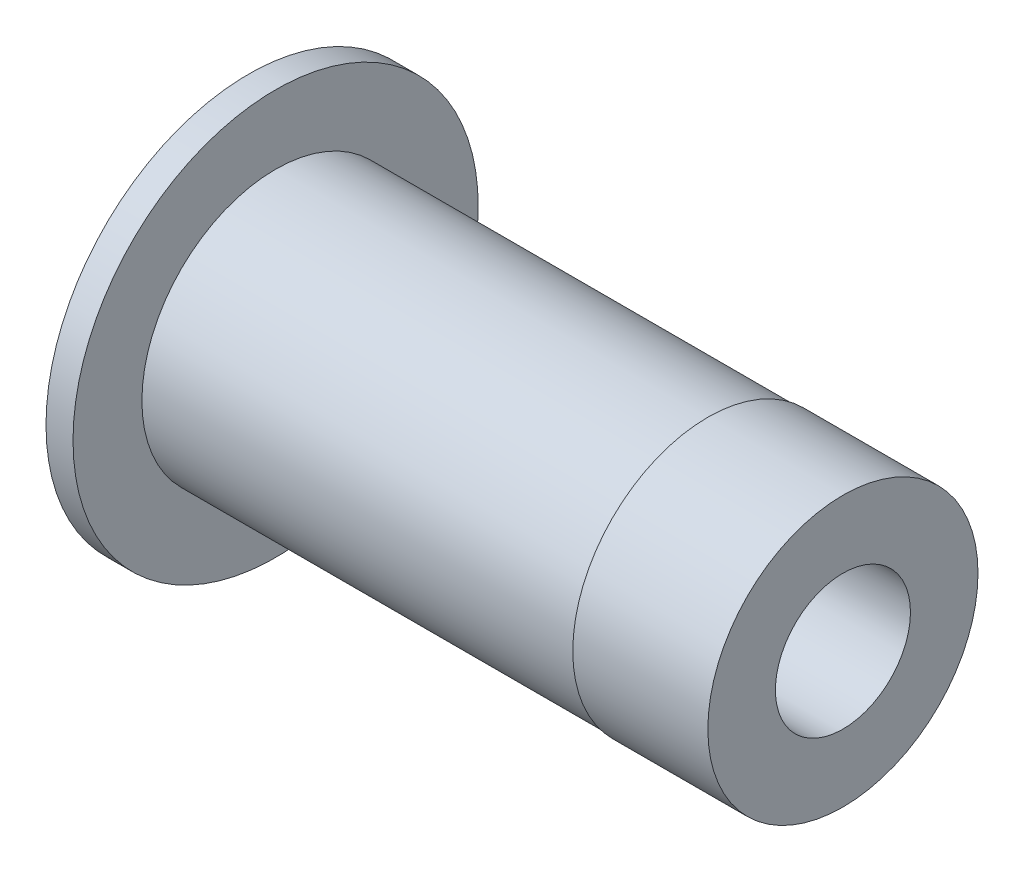
from build123d import *

# Parameters (mm, degrees)
SKETCH1_R           = 9.9
BOSS_EXTRUDE1_DEPTH = 32
SKETCH2_R           = 10
SKETCH2_R_2         = 5
BOSS_EXTRUDE2_DEPTH = 10
SKETCH3_R           = 15
BOSS_EXTRUDE3_DEPTH = 2


with BuildPart() as part:
    # Sketch1 → Boss-Extrude1 (new body)
    with BuildSketch(Plane(origin=(0, 0, 0), x_dir=(0, 0, -1), z_dir=(1, 0, 0))):
        Circle(SKETCH1_R)
    extrude(amount=BOSS_EXTRUDE1_DEPTH)

    # Sketch3 → Boss-Extrude3 (add)
    with BuildSketch(Plane.ZY):
        Circle(SKETCH3_R)
    extrude(amount=BOSS_EXTRUDE3_DEPTH)


with BuildPart() as body_2:
    # Sketch2 → Boss-Extrude2 (new body)
    with BuildSketch(Plane(origin=(32, 0, 0), x_dir=(0, 0, -1), z_dir=(1, 0, 0))):
        Circle(SKETCH2_R)
        Circle(SKETCH2_R_2, mode=Mode.SUBTRACT)
    extrude(amount=BOSS_EXTRUDE2_DEPTH)


solid = Compound([part.part, body_2.part])
